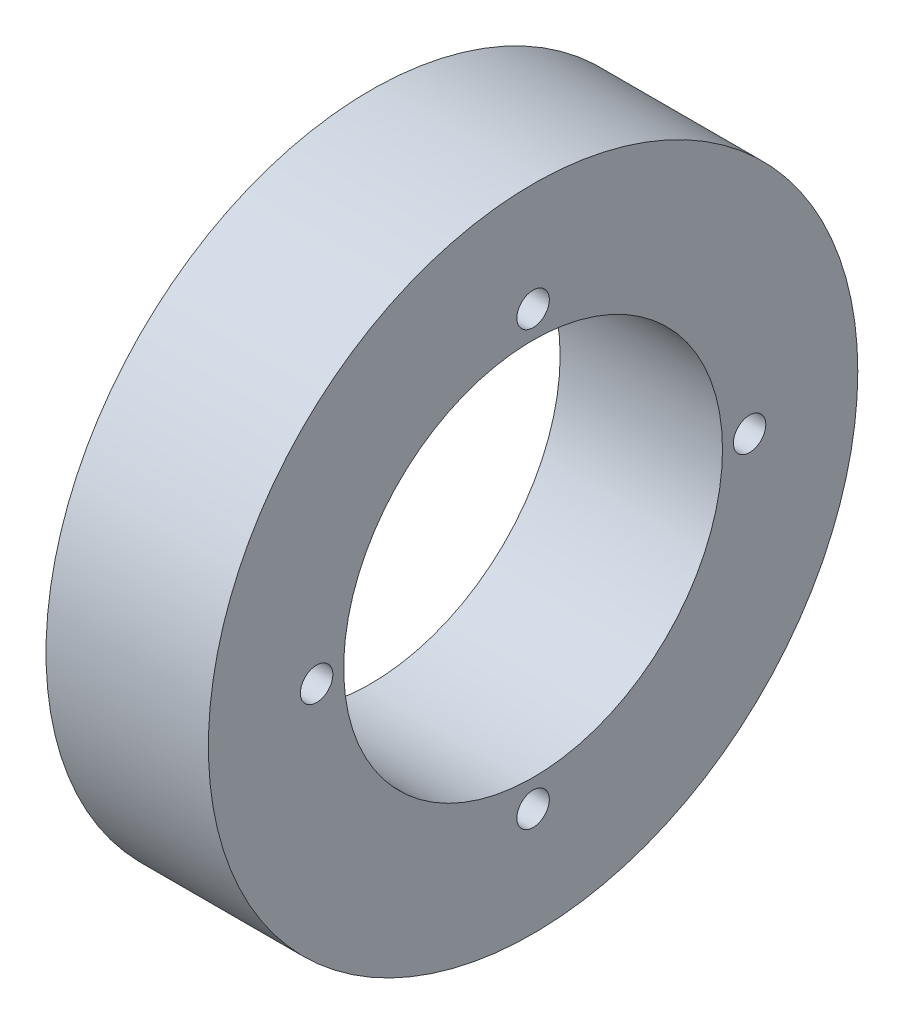
from build123d import *

# Parameters (mm, degrees)
SKETCH1_R           = 30
SKETCH1_R_2         = 17.5
BOSS_EXTRUDE1_DEPTH = 7.5
SKETCH2_R           = 1.5
CUT_EXTRUDE1_DEPTH  = 46


with BuildPart() as part:
    # Sketch1 → Boss-Extrude1 (new, symmetric)
    with BuildSketch(Plane(origin=(0, 0, 0), x_dir=(0, 0, -1), z_dir=(1, 0, 0))):
        Circle(SKETCH1_R)
        Circle(SKETCH1_R_2, mode=Mode.SUBTRACT)
    extrude(amount=BOSS_EXTRUDE1_DEPTH, both=True)

    # Sketch2 → Cut-Extrude1 (cut, through all)
    with BuildSketch(Plane(origin=(7.5, 0, 0), x_dir=(0, 0, -1), z_dir=(1, 0, 0))):
        with Locations((0, 20)):
            Circle(SKETCH2_R)
        with Locations((20, 0)):
            Circle(SKETCH2_R)
        with Locations((0, -20)):
            Circle(SKETCH2_R)
        with Locations((-20, 0)):
            Circle(SKETCH2_R)
    extrude(amount=-CUT_EXTRUDE1_DEPTH, mode=Mode.SUBTRACT)


solid = part.part
